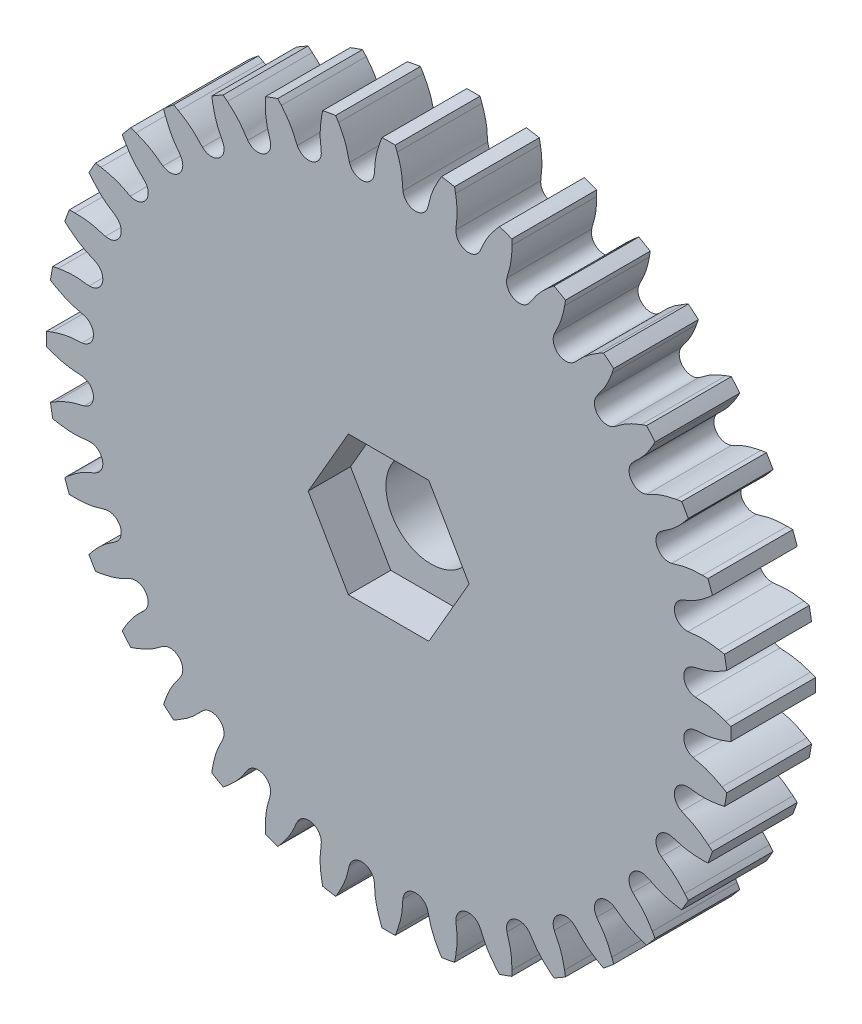
from build123d import *

# Parameters (mm, degrees)
SKETCH5_R           = 20.510499989
BOSS_EXTRUDE1_DEPTH = 5.08
CUT_EXTRUDE1_DEPTH  = 446.215032214
CIRPATTERN1_COUNT   = 36
SKETCH10_R          = 2.7
CUT_EXTRUDE2_DEPTH  = 446.215032345
CUT_EXTRUDE3_DEPTH  = 2.54


with BuildPart() as part:
    # Sketch5 → Boss-Extrude1 (new body)
    with BuildSketch(Plane.XY):
        with Locations((395.233023584, 138.699867504)):
            Circle(SKETCH5_R)
    extrude(amount=BOSS_EXTRUDE1_DEPTH)

    # Sketch7 → Cut-Extrude1 (cut, through all)
    with BuildSketch(Plane(origin=(0, 0, 0), x_dir=(-1, 0, 0), z_dir=(0, 0, -1))):
        with BuildLine():
            ThreePointArc((-395.611207169, 159.243248314), (-397.063496693, 159.622271537), (-398.427905983, 158.996819099))
            ThreePointArc((-398.427905983, 158.996819099), (-398.329283311, 158.838970684), (-398.2342999, 158.678905993))
            add(Edge.make_bspline(
                [(-397.575692328, 156.939242614), (-397.630189376, 157.091717813), (-397.69088938, 157.421838637), (-397.866400653, 157.982954752), (-398.079698716, 158.41120804), (-398.2342999, 158.678905993)],
                knots=[1.0302e-05, 1.0302e-05, 1.0302e-05, 1.0302e-05, 0.249512715, 0.499015129, 0.998019957, 0.998019957, 0.998019957, 0.998019957], degree=3))
            ThreePointArc((-397.575692328, 156.939242614), (-396.780561749, 156.388310353), (-396.093179375, 157.068945694))
            add(Edge.make_bspline(
                [(-395.746666909, 158.896545679), (-395.852434091, 158.606068445), (-395.988126279, 158.147282467), (-396.063534343, 157.56421375), (-396.065987309, 157.228567764), (-396.093179375, 157.068945694)],
                knots=[0.001980042, 0.001980042, 0.001980042, 0.001980042, 0.50098487, 0.750487284, 0.999989698, 0.999989698, 0.999989698, 0.999989698], degree=3))
            ThreePointArc((-395.746666909, 158.896545679), (-395.680921452, 159.070672324), (-395.611207169, 159.243248314))
        make_face()
    cut_extrude1 = extrude(amount=-CUT_EXTRUDE1_DEPTH, mode=Mode.SUBTRACT)

    # CirPattern1: Cut-Extrude1 ×36 about axis
    cirpattern1_axis = Axis((395.233023584, 138.699867504, 5.08), (0, 0, -1))
    for i in range(1, CIRPATTERN1_COUNT):
        add(cut_extrude1.rotate(cirpattern1_axis, i * 360 / CIRPATTERN1_COUNT), mode=Mode.SUBTRACT)

    # Sketch10 → Cut-Extrude2 (cut, through all)
    with BuildSketch(Plane.XY.offset(5.08)):
        with Locations((395.233023584, 138.699867504)):
            Circle(SKETCH10_R)
    extrude(amount=-CUT_EXTRUDE2_DEPTH, mode=Mode.SUBTRACT)

    # Sketch11 → Cut-Extrude3 (cut)
    with BuildSketch(Plane.XY.offset(5.08)):
        Polygon((392.82258621, 142.817294914), (397.643460958, 142.817294914), (400.053898332, 138.642294914), (397.643460958, 134.467294914), (392.82258621, 134.467294914), (390.412148836, 138.642294914), align=None)
    extrude(amount=-CUT_EXTRUDE3_DEPTH, mode=Mode.SUBTRACT)


solid = part.part
